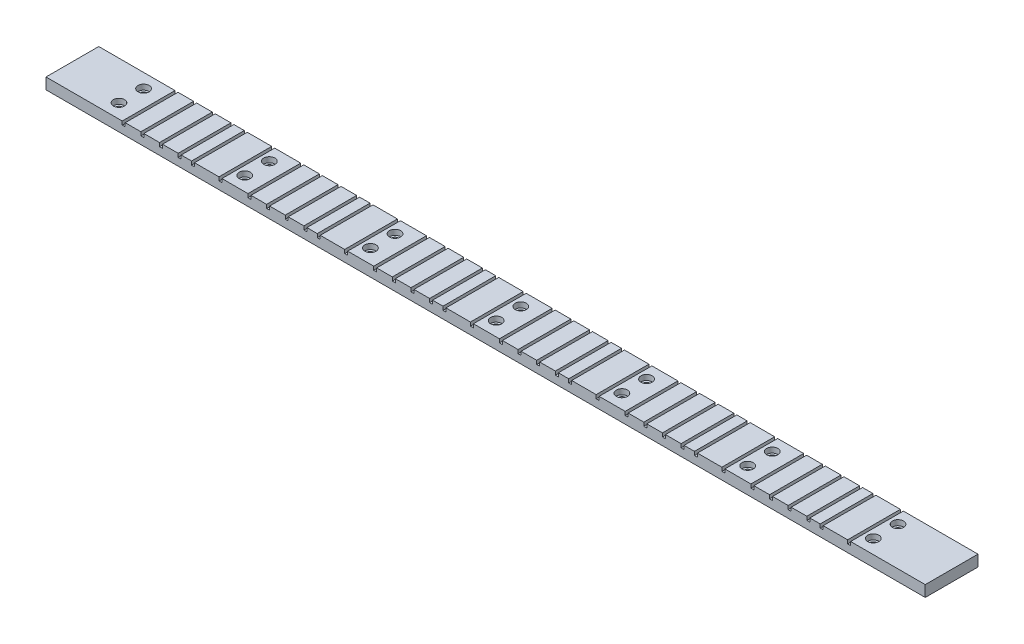
from build123d import *

# Parameters (mm, degrees)
SKETCH1_W           = 500
SKETCH1_H           = 30
BOSS_EXTRUDE1_DEPTH = 6.35
SKETCH2_R           = 3.175
CUT_EXTRUDE1_DEPTH  = 3
CUT_EXTRUDE2_DEPTH  = 402.147008589
SKETCH6_R           = 1.89865
CUT_EXTRUDE3_DEPTH  = 404.162898219


with BuildPart() as part:
    # Sketch1 → Boss-Extrude1 (new body)
    with BuildSketch(Plane(origin=(0, 2, 0), x_dir=(-1, 0, 0), z_dir=(0, -1, 0))):
        with Locations((-150, 35)):
            Rectangle(SKETCH1_W, SKETCH1_H)
    extrude(amount=BOSS_EXTRUDE1_DEPTH)

    # Sketch2 → Cut-Extrude1 (cut)
    with BuildSketch(Plane.XZ.offset(-2)):
        with Locations((5, -28)):
            Circle(SKETCH2_R)
        with Locations((-66.5, -42)):
            Circle(SKETCH2_R)
        with Locations((-66.5, -28)):
            Circle(SKETCH2_R)
        with Locations((5, -42)):
            Circle(SKETCH2_R)
        with Locations((76.5, -28)):
            Circle(SKETCH2_R)
        with Locations((76.5, -42)):
            Circle(SKETCH2_R)
        with Locations((148, -28)):
            Circle(SKETCH2_R)
        with Locations((148, -42)):
            Circle(SKETCH2_R)
        with Locations((219.5, -28)):
            Circle(SKETCH2_R)
        with Locations((219.5, -42)):
            Circle(SKETCH2_R)
        with Locations((291, -28)):
            Circle(SKETCH2_R)
        with Locations((291, -42)):
            Circle(SKETCH2_R)
        with Locations((362.5, -28)):
            Circle(SKETCH2_R)
        with Locations((362.5, -42)):
            Circle(SKETCH2_R)
    extrude(amount=CUT_EXTRUDE1_DEPTH, mode=Mode.SUBTRACT)

    # Sketch5 → Cut-Extrude2 (cut, through all)
    with BuildSketch(Plane(origin=(0, 0, -50), x_dir=(-1, 0, 0), z_dir=(0, 0, -1))):
        Polygon((-1.574705718, 2.00006084), (-0.057166038, 2.00006084), (-0.057166038, -0.05708916), (1.644633962, -0.05708916), (1.644633962, 2.00006084), (15.542833962, 2.00006084), (15.542833962, -0.05708916), (17.244633962, -0.05708916), (17.244633962, 2.00006084), (23.142833962, 2.00006084), (23.142833962, -0.05708916), (24.844633962, -0.05708916), (24.844633962, 2.00006084), (33.742833962, 2.00006084), (33.742833962, -0.05708916), (35.444633962, -0.05708916), (35.444633962, 2.00006084), (44.342833962, 2.00006084), (44.342833962, -0.05708916), (46.044633962, -0.05708916), (46.044633962, 2.00006084), (54.942833962, 2.00006084), (54.942833962, -0.05708916), (56.644633962, -0.05708916), (56.644633962, 2.00006084), (61.710485811, 2.00006084), (61.710485811, 3.366834616), (-1.574705718, 3.366834616), align=None)
        Polygon((-73.074705718, 2.00006084), (-71.557166038, 2.00006084), (-71.557166038, -0.05708916), (-69.855366038, -0.05708916), (-69.855366038, 2.00006084), (-55.957166038, 2.00006084), (-55.957166038, -0.05708916), (-54.255366038, -0.05708916), (-54.255366038, 2.00006084), (-48.357166038, 2.00006084), (-48.357166038, -0.05708916), (-46.655366038, -0.05708916), (-46.655366038, 2.00006084), (-37.757166038, 2.00006084), (-37.757166038, -0.05708916), (-36.055366038, -0.05708916), (-36.055366038, 2.00006084), (-27.157166038, 2.00006084), (-27.157166038, -0.05708916), (-25.455366038, -0.05708916), (-25.455366038, 2.00006084), (-16.557166038, 2.00006084), (-16.557166038, -0.05708916), (-14.855366038, -0.05708916), (-14.855366038, 2.00006084), (-9.789514189, 2.00006084), (-9.789514189, 3.366834616), (-73.074705718, 3.366834616), align=None)
        Polygon((-144.574705718, 2.00006084), (-143.057166038, 2.00006084), (-143.057166038, -0.05708916), (-141.355366038, -0.05708916), (-141.355366038, 2.00006084), (-127.457166038, 2.00006084), (-127.457166038, -0.05708916), (-125.755366038, -0.05708916), (-125.755366038, 2.00006084), (-119.857166038, 2.00006084), (-119.857166038, -0.05708916), (-118.155366038, -0.05708916), (-118.155366038, 2.00006084), (-109.257166038, 2.00006084), (-109.257166038, -0.05708916), (-107.555366038, -0.05708916), (-107.555366038, 2.00006084), (-98.657166038, 2.00006084), (-98.657166038, -0.05708916), (-96.955366038, -0.05708916), (-96.955366038, 2.00006084), (-88.057166038, 2.00006084), (-88.057166038, -0.05708916), (-86.355366038, -0.05708916), (-86.355366038, 2.00006084), (-81.289514189, 2.00006084), (-81.289514189, 3.366834616), (-144.574705718, 3.366834616), align=None)
        Polygon((-216.074705718, 2.00006084), (-214.557166038, 2.00006084), (-214.557166038, -0.05708916), (-212.855366038, -0.05708916), (-212.855366038, 2.00006084), (-198.957166038, 2.00006084), (-198.957166038, -0.05708916), (-197.255366038, -0.05708916), (-197.255366038, 2.00006084), (-191.357166038, 2.00006084), (-191.357166038, -0.05708916), (-189.655366038, -0.05708916), (-189.655366038, 2.00006084), (-180.757166038, 2.00006084), (-180.757166038, -0.05708916), (-179.055366038, -0.05708916), (-179.055366038, 2.00006084), (-170.157166038, 2.00006084), (-170.157166038, -0.05708916), (-168.455366038, -0.05708916), (-168.455366038, 2.00006084), (-159.557166038, 2.00006084), (-159.557166038, -0.05708916), (-157.855366038, -0.05708916), (-157.855366038, 2.00006084), (-152.789514189, 2.00006084), (-152.789514189, 3.366834616), (-216.074705718, 3.366834616), align=None)
        Polygon((-287.574705718, 2.00006084), (-286.057166038, 2.00006084), (-286.057166038, -0.05708916), (-284.355366038, -0.05708916), (-284.355366038, 2.00006084), (-270.457166038, 2.00006084), (-270.457166038, -0.05708916), (-268.755366038, -0.05708916), (-268.755366038, 2.00006084), (-262.857166038, 2.00006084), (-262.857166038, -0.05708916), (-261.155366038, -0.05708916), (-261.155366038, 2.00006084), (-252.257166038, 2.00006084), (-252.257166038, -0.05708916), (-250.555366038, -0.05708916), (-250.555366038, 2.00006084), (-241.657166038, 2.00006084), (-241.657166038, -0.05708916), (-239.955366038, -0.05708916), (-239.955366038, 2.00006084), (-231.057166038, 2.00006084), (-231.057166038, -0.05708916), (-229.355366038, -0.05708916), (-229.355366038, 2.00006084), (-224.289514189, 2.00006084), (-224.289514189, 3.366834616), (-287.574705718, 3.366834616), align=None)
        Polygon((-359.074705718, 2.00006084), (-357.557166038, 2.00006084), (-357.557166038, -0.05708916), (-355.855366038, -0.05708916), (-355.855366038, 2.00006084), (-341.957166038, 2.00006084), (-341.957166038, -0.05708916), (-340.255366038, -0.05708916), (-340.255366038, 2.00006084), (-334.357166038, 2.00006084), (-334.357166038, -0.05708916), (-332.655366038, -0.05708916), (-332.655366038, 2.00006084), (-323.757166038, 2.00006084), (-323.757166038, -0.05708916), (-322.055366038, -0.05708916), (-322.055366038, 2.00006084), (-313.157166038, 2.00006084), (-313.157166038, -0.05708916), (-311.455366038, -0.05708916), (-311.455366038, 2.00006084), (-302.557166038, 2.00006084), (-302.557166038, -0.05708916), (-300.855366038, -0.05708916), (-300.855366038, 2.00006084), (-295.789514189, 2.00006084), (-295.789514189, 3.366834616), (-359.074705718, 3.366834616), align=None)
    extrude(amount=-CUT_EXTRUDE2_DEPTH, mode=Mode.SUBTRACT)

    # Sketch6 → Cut-Extrude3 (cut, through all)
    with BuildSketch(Plane.XZ.offset(4.35)):
        with Locations((-66.5, -42)):
            Circle(SKETCH6_R)
        with Locations((-66.5, -28)):
            Circle(SKETCH6_R)
        with Locations((5, -42)):
            Circle(SKETCH6_R)
        with Locations((5, -28)):
            Circle(SKETCH6_R)
        with Locations((76.5, -42)):
            Circle(SKETCH6_R)
        with Locations((76.5, -28)):
            Circle(SKETCH6_R)
        with Locations((148, -42)):
            Circle(SKETCH6_R)
        with Locations((148, -28)):
            Circle(SKETCH6_R)
        with Locations((219.5, -42)):
            Circle(SKETCH6_R)
        with Locations((219.5, -28)):
            Circle(SKETCH6_R)
        with Locations((291, -42)):
            Circle(SKETCH6_R)
        with Locations((291, -28)):
            Circle(SKETCH6_R)
        with Locations((362.5, -42)):
            Circle(SKETCH6_R)
        with Locations((362.5, -28)):
            Circle(SKETCH6_R)
    extrude(amount=-CUT_EXTRUDE3_DEPTH, mode=Mode.SUBTRACT)


solid = part.part
